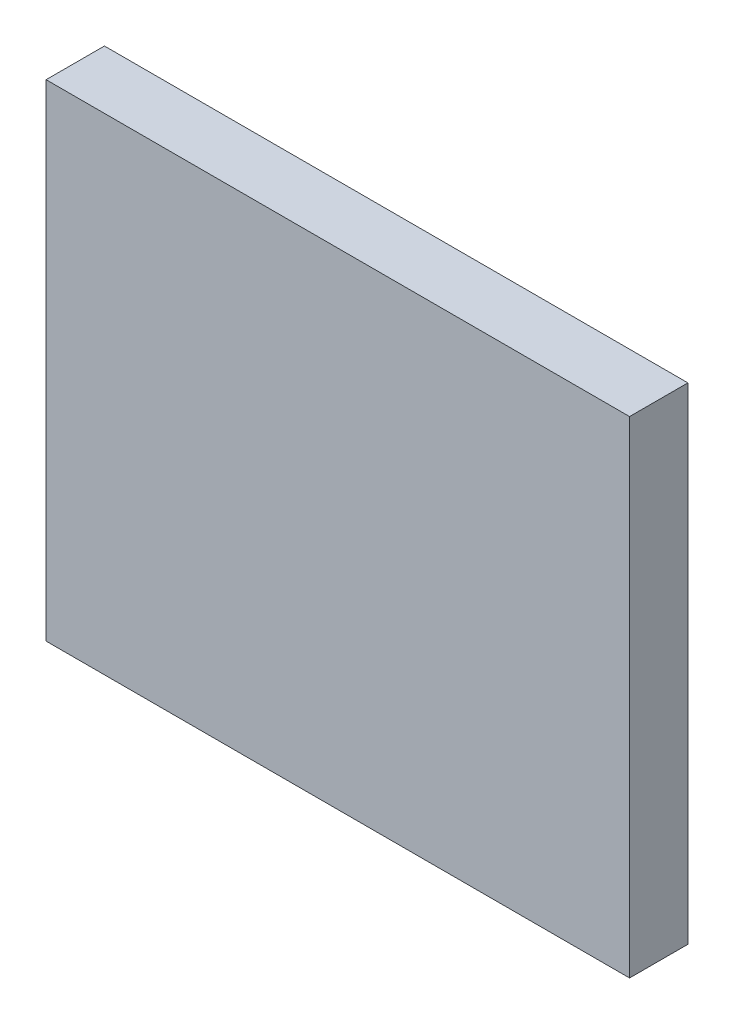
from build123d import *

# Parameters (mm, degrees)
SKETCH_1_W      = 30
SKETCH_1_H      = 25
EXTRUDE_1_DEPTH = 3


with BuildPart() as part:
    # 草图1 → 凸台-拉伸1 (new body)
    with BuildSketch(Plane.XY):
        Rectangle(SKETCH_1_W, SKETCH_1_H)
    extrude(amount=EXTRUDE_1_DEPTH)


solid = part.part
